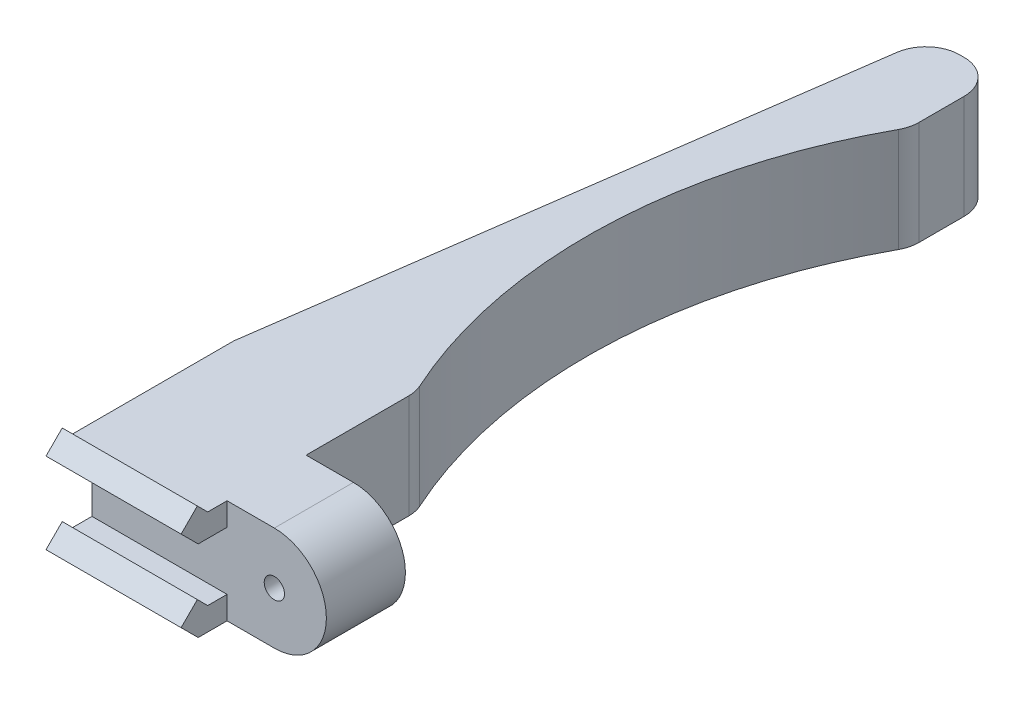
from build123d import *

# Parameters (mm, degrees)
SKETCH1_W           = 10
SKETCH1_H           = 14.76841244
BOSS_EXTRUDE1_DEPTH = 2.5
BOSS_EXTRUDE2_DEPTH = 10
CUT_EXTRUDE1_REACH  = 15.761
SKETCH3_W           = 5
SKETCH3_H           = 2.487575025
SKETCH3_H_2         = 4.580837415
BOSS_EXTRUDE3_DEPTH = 7.7
SKETCH6_R           = 0.75
BOSS_EXTRUDE4_DEPTH = 5.85
FILLET1_R           = 2.5


with BuildPart() as part:
    # Sketch1 → Boss-Extrude1 (new, symmetric)
    with BuildSketch(Plane.XY):
        Rectangle(SKETCH1_W, SKETCH1_H)
    extrude(amount=BOSS_EXTRUDE1_DEPTH, both=True)

    # Sketch2 → Boss-Extrude2 (add)
    with BuildSketch(Plane(origin=(5, 0, 0), x_dir=(0, 0, -1), z_dir=(1, 0, 0))):
        Polygon((-2.65, 4.896631195), (-2.5, 4.896631195), (-2.5, 3.196631195), (-2.65, 3.196631195), (-4.637867966, 3.196631195), (-5.902081528, 4.460844758), (-4.7, 5.662926286), (-3.93370491, 4.896631195), align=None)
        Polygon((-2.65, -1.103368805), (-2.5, -1.103368805), (-2.5, -2.803368805), (-2.65, -2.803368805), (-4.637867966, -2.803368805), (-5.902081528, -1.539155242), (-4.7, -0.337073714), (-3.93370491, -1.103368805), align=None)
    extrude(amount=-BOSS_EXTRUDE2_DEPTH)

    # Sketch3 → Cut-Extrude1 (cut, up to next)
    with BuildSketch(Plane(origin=(5, 0, 0), x_dir=(0, 0, -1), z_dir=(1, 0, 0)), mode=Mode.PRIVATE) as cut_extrude1_sk1:
        with Locations((0, 6.140418708)):
            Rectangle(SKETCH3_W, SKETCH3_H)
    cut_extrude1_tool1 = extrude(cut_extrude1_sk1.sketch, amount=-CUT_EXTRUDE1_REACH, mode=Mode.PRIVATE) & part.part
    # Sketch3 → Cut-Extrude1 (cut, up to next)
    with BuildSketch(Plane(origin=(5, 0, 0), x_dir=(0, 0, -1), z_dir=(1, 0, 0)), mode=Mode.PRIVATE) as cut_extrude1_sk2:
        with Locations((0, -5.093787513)):
            Rectangle(SKETCH3_W, SKETCH3_H_2)
    cut_extrude1_tool2 = extrude(cut_extrude1_sk2.sketch, amount=-CUT_EXTRUDE1_REACH, mode=Mode.PRIVATE) & part.part
    add(cut_extrude1_tool1.solids().sort_by_distance((5, 6.140419, 0))[0], mode=Mode.SUBTRACT)
    add(cut_extrude1_tool2.solids().sort_by_distance((5, -5.093788, 0))[0], mode=Mode.SUBTRACT)

    # Sketch5 → Boss-Extrude3 (add)
    with BuildSketch(Plane.XZ.offset(2.803368805)):
        with BuildLine():
            Line((-5, -2.5), (-5, -8))
            Line((-5, -8), (1.352445729, -53.2))
            Line((1.352445729, -53.2), (6.352445729, -53.2))
            Line((6.352445729, -53.2), (6.352445729, -46.7))
            ThreePointArc((6.352445729, -46.7), (1.383429579, -29.264936646), (5, -11.5))
            Line((5, -11.5), (5, -2.5))
            Line((5, -2.5), (-5, -2.5))
        make_face()
    extrude(amount=-BOSS_EXTRUDE3_DEPTH)

    # Sketch6 → Boss-Extrude4 (add)
    with BuildSketch(Plane.XY.offset(2.5)):
        with BuildLine():
            Line((5, 4.896631195), (8.5, 4.896631195))
            ThreePointArc((8.5, 4.896631195), (12.35, 1.046631195), (8.5, -2.803368805))
            Line((8.5, -2.803368805), (5, -2.803368805))
            Line((5, -2.803368805), (5, 4.896631195))
        make_face()
        with Locations((8.5, 1.046631195)):
            Circle(SKETCH6_R, mode=Mode.SUBTRACT)
    extrude(amount=-BOSS_EXTRUDE4_DEPTH)

    # Fillet1
    fillet1_edges = [part.edges().sort_by_distance(p)[0] for p in [
        (6.352445729, 1.046631195, -46.7),
        (5, 1.046631195, -11.5),
        (1.352445729, 1.046631195, -53.2),
        (6.352445729, 1.046631195, -53.2),
    ]]
    fillet(fillet1_edges, radius=FILLET1_R)


solid = part.part
